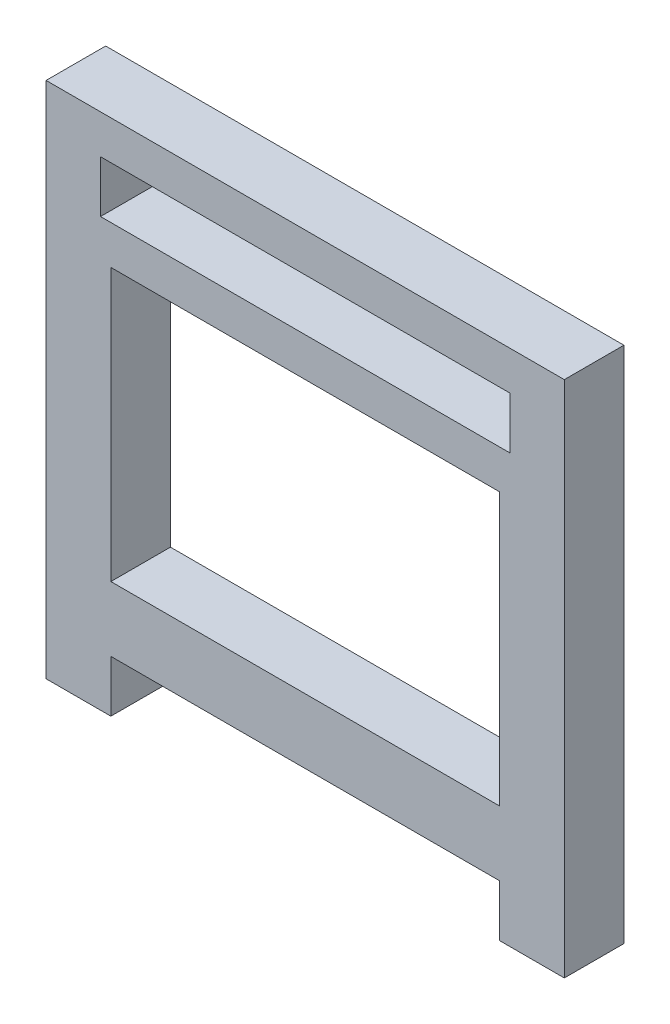
from build123d import *

# Parameters (mm, degrees)
SKETCH1_W           = 15
SKETCH1_H           = 10.5
SKETCH1_W_2         = 15.8
SKETCH1_H_2         = 2
BOSS_EXTRUDE1_DEPTH = 2.3


with BuildPart() as part:
    # Sketch1 → Boss-Extrude1 (new body)
    with BuildSketch(Plane.XY):
        Polygon((0, 0), (0, -2), (2.5, -2), (2.5, 0), (17.5, 0), (17.5, -2), (20, -2), (20, 0), (20, 18), (0, 18), align=None)
        with Locations((10, 7.75)):
            Rectangle(SKETCH1_W, SKETCH1_H, mode=Mode.SUBTRACT)
        with Locations((10, 15.5)):
            Rectangle(SKETCH1_W_2, SKETCH1_H_2, mode=Mode.SUBTRACT)
    extrude(amount=BOSS_EXTRUDE1_DEPTH)


solid = part.part
